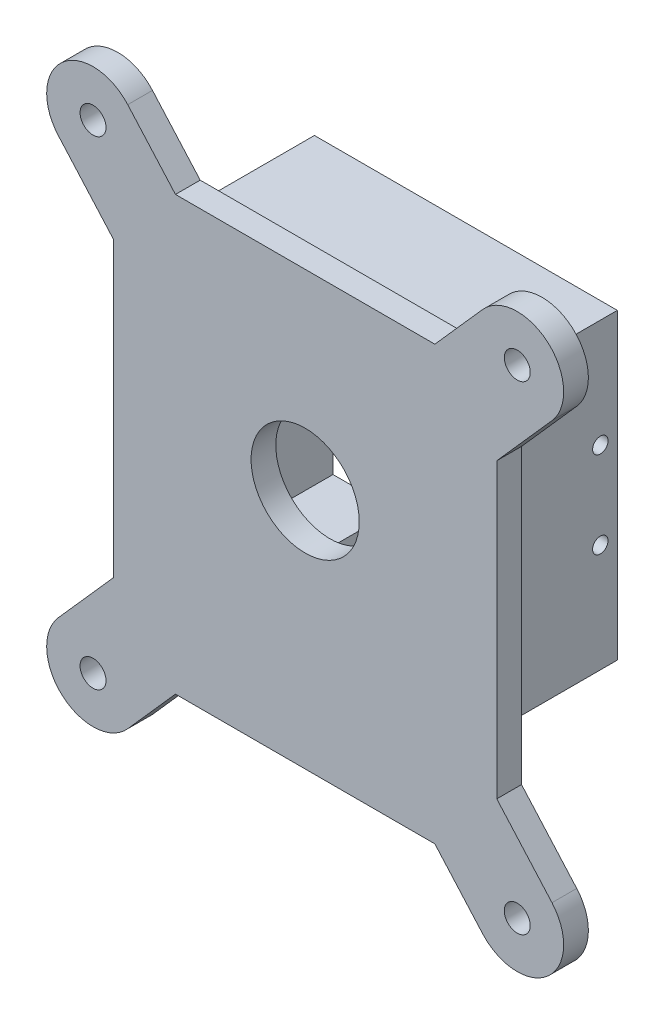
from build123d import *

# Parameters (mm, degrees)
SKETCH1_W               = 62
SKETCH1_H               = 70
SKETCH1_R               = 8.75
BOTTOM_DEPTH            = 4
SKETCH2_R               = 3.25
SKETCH2_R_2             = 3.75
SCREW_INLETS_DEPTH      = 2.3
SKETCH3_R               = 2.1
MOUNTING_ARMS_DEPTH     = 4
WALLS_DEPTH             = 22
ADAPTER_BOLT_HOLE_REACH = 102.081
SKETCH5_R               = 4
M2_LOCK_HOLES_REACH     = 96.241
SKETCH7_R               = 1.25


with BuildPart() as part:
    # Sketch1 → Bottom (new body)
    with BuildSketch(Plane.XY):
        with Locations((21, 17)):
            Rectangle(SKETCH1_W, SKETCH1_H)
        with Locations((21, 21)):
            Circle(SKETCH1_R, mode=Mode.SUBTRACT)
    extrude(amount=BOTTOM_DEPTH)

    # Sketch2 → Screw_inlets (cut)
    with BuildSketch(Plane(origin=(0, 0, 0), x_dir=(-1, 0, 0), z_dir=(0, 0, -1))):
        with Locations((-37.5, 4.5)):
            Circle(SKETCH2_R)
        with Locations((-37.5, 37.5)):
            Circle(SKETCH2_R)
        with Locations((-27, 4)):
            Circle(SKETCH2_R_2)
        with Locations((-15, 4)):
            Circle(SKETCH2_R_2)
        with Locations((-4.5, 4.5)):
            Circle(SKETCH2_R)
        with Locations((-4.5, 37.5)):
            Circle(SKETCH2_R)
    extrude(amount=-SCREW_INLETS_DEPTH, mode=Mode.SUBTRACT)

    # Sketch3 → Mounting_arms (add)
    # profile 1 of 4: a face of its own
    with BuildSketch(Plane(origin=(0, 0, 0), x_dir=(-1, 0, 0), z_dir=(0, 0, -1))):
        with BuildLine():
            Line((10, 40.688384135), (18.929587578, 50.770176561))
            ThreePointArc((18.929587578, 50.770176561), (18.287940566, 61.357352252), (7.700764875, 60.715705241))
            Line((7.700764875, 60.715705241), (-0.018859766, 52))
            Line((-0.018859766, 52), (10, 52))
            Line((10, 52), (10, 40.688384135))
        make_face()
        with Locations((13.315176226, 55.742940901)):
            Circle(SKETCH3_R, mode=Mode.SUBTRACT)
    # profile 2 of 4: a face of its own
    with BuildSketch(Plane(origin=(0, 0, 0), x_dir=(-1, 0, 0), z_dir=(0, 0, -1))):
        with BuildLine():
            Line((-52, 40.688384135), (-60.929587578, 50.770176561))
            ThreePointArc((-60.929587578, 50.770176561), (-60.287940566, 61.357352252), (-49.700764875, 60.715705241))
            Line((-49.700764875, 60.715705241), (-41.981140234, 52))
            Line((-41.981140234, 52), (-52, 52))
            Line((-52, 52), (-52, 40.688384135))
        make_face()
        with Locations((-55.315176226, 55.742940901)):
            Circle(SKETCH3_R, mode=Mode.SUBTRACT)
    # profile 3 of 4: a face of its own
    with BuildSketch(Plane(origin=(0, 0, 0), x_dir=(-1, 0, 0), z_dir=(0, 0, -1))):
        with BuildLine():
            Line((10, -6.688384135), (18.929587578, -16.770176561))
            ThreePointArc((18.929587578, -16.770176561), (18.287940566, -27.357352252), (7.700764875, -26.715705241))
            Line((7.700764875, -26.715705241), (-0.018859766, -18))
            Line((-0.018859766, -18), (10, -18))
            Line((10, -18), (10, -6.688384135))
        make_face()
        with Locations((13.315176226, -21.742940901)):
            Circle(SKETCH3_R, mode=Mode.SUBTRACT)
    # profile 4 of 4: a face of its own
    with BuildSketch(Plane(origin=(0, 0, 0), x_dir=(-1, 0, 0), z_dir=(0, 0, -1))):
        with BuildLine():
            Line((-52, -18), (-52, -6.688384135))
            Line((-52, -6.688384135), (-60.929587578, -16.770176561))
            ThreePointArc((-60.929587578, -16.770176561), (-60.287940566, -27.357352252), (-49.700764875, -26.715705241))
            Line((-49.700764875, -26.715705241), (-41.981140234, -18))
            Line((-41.981140234, -18), (-52, -18))
        make_face()
        with Locations((-55.315176226, -21.742940901)):
            Circle(SKETCH3_R, mode=Mode.SUBTRACT)
    extrude(amount=-MOUNTING_ARMS_DEPTH)

    # Sketch4 → Walls (add)
    with BuildSketch(Plane(origin=(0, 0, 0), x_dir=(-1, 0, 0), z_dir=(0, 0, -1))):
        Polygon((-6.5, -11.5), (-35.5, -11.5), (-35.5, -3.5), (-45.5, -3.5), (-45.5, 45.5), (3.5, 45.5), (3.5, -3.5), (-6.5, -3.5), align=None)
        Polygon((-9.5, -8.5), (-32.5, -8.5), (-32.5, -0.5), (-42.5, -0.5), (-42.5, 42.5), (0.5, 42.5), (0.5, -0.5), (-9.5, -0.5), align=None, mode=Mode.SUBTRACT)
    extrude(amount=WALLS_DEPTH)

    # Sketch5 → Adapter_bolt_hole (cut, up to next)
    with BuildSketch(Plane.XZ.offset(11.5), mode=Mode.PRIVATE) as adapter_bolt_hole_sk1:
        with Locations(Location((21, -8.5, 0), (0, 0, 270))):
            Circle(SKETCH5_R)
    adapter_bolt_hole_tool1 = extrude(adapter_bolt_hole_sk1.sketch, amount=-ADAPTER_BOLT_HOLE_REACH, mode=Mode.PRIVATE) & part.part
    add(adapter_bolt_hole_tool1.solids().sort_by_distance((21, -11.5, -8.5))[0], mode=Mode.SUBTRACT)

    # M2_lock_holes: up to this face of the body (flat: up to its plane)
    m2_lock_holes_end = Plane(part.part.faces().sort_by_distance((-3.5, 21, -11))[0])
    # Sketch7 → M2_lock_holes (cut, up to the picked face)
    with BuildSketch(Plane(origin=(45.5, 0, 0), x_dir=(0, 0, -1), z_dir=(1, 0, 0)), mode=Mode.PRIVATE) as m2_lock_holes_sk1:
        with Locations(Location((19.25, 28, 0), (0, 0, 90))):
            Circle(SKETCH7_R)
    m2_lock_holes_tool1 = split(extrude(m2_lock_holes_sk1.sketch, amount=-M2_LOCK_HOLES_REACH, mode=Mode.PRIVATE), bisect_by=m2_lock_holes_end, keep=Keep.BOTH, mode=Mode.PRIVATE)
    # Sketch7 → M2_lock_holes (cut, up to the picked face)
    with BuildSketch(Plane(origin=(45.5, 0, 0), x_dir=(0, 0, -1), z_dir=(1, 0, 0)), mode=Mode.PRIVATE) as m2_lock_holes_sk2:
        with Locations(Location((19.25, 14, 0), (0, 0, 90))):
            Circle(SKETCH7_R)
    m2_lock_holes_tool2 = split(extrude(m2_lock_holes_sk2.sketch, amount=-M2_LOCK_HOLES_REACH, mode=Mode.PRIVATE), bisect_by=m2_lock_holes_end, keep=Keep.BOTH, mode=Mode.PRIVATE)
    add(m2_lock_holes_tool1.solids().sort_by(Axis((45.5, 28, -19.25), (-1, 0, 0)))[0], mode=Mode.SUBTRACT)
    add(m2_lock_holes_tool2.solids().sort_by(Axis((45.5, 14, -19.25), (-1, 0, 0)))[0], mode=Mode.SUBTRACT)


solid = part.part
